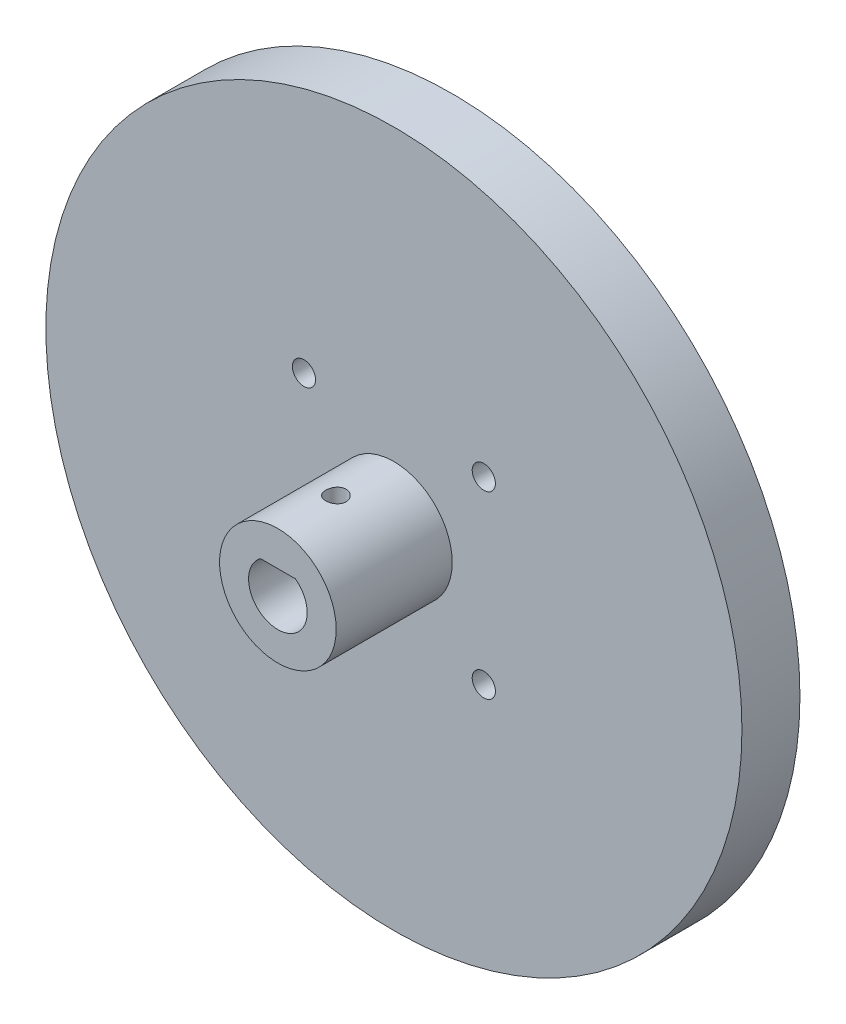
from build123d import *

# Parameters (mm, degrees)
SKETCH1_R               = 60
SKETCH1_R_2             = 2
BOSS_EXTRUDE1_DEPTH     = 10
SKETCH2_R               = 10.05
BOSS_EXTRUDE2_DEPTH     = 20
CUT_EXTRUDE1_DEPTH      = 20
CUT_EXTRUDE1_DEPTH_BACK = 20
SKETCH3_R               = 1.75


with BuildPart() as part:
    # Sketch1 → Boss-Extrude1 (new body)
    with BuildSketch(Plane.XY):
        Circle(SKETCH1_R)
        with Locations((-15.5, 15.5)):
            Circle(SKETCH1_R_2, mode=Mode.SUBTRACT)
        with Locations((15.5, 15.5)):
            Circle(SKETCH1_R_2, mode=Mode.SUBTRACT)
        with Locations((15.5, -15.5)):
            Circle(SKETCH1_R_2, mode=Mode.SUBTRACT)
        with Locations((-15.5, -15.5)):
            Circle(SKETCH1_R_2, mode=Mode.SUBTRACT)
    extrude(amount=BOSS_EXTRUDE1_DEPTH)

    # Sketch2 → Boss-Extrude2 (add)
    with BuildSketch(Plane.XY.offset(10)):
        Circle(SKETCH2_R)
        with BuildLine():
            ThreePointArc((3.016620626, 4.05), (0, -5.05), (-3.016620626, 4.05))
            Line((-3.016620626, 4.05), (3.016620626, 4.05))
        make_face(mode=Mode.SUBTRACT)
    extrude(amount=BOSS_EXTRUDE2_DEPTH)

    # Sketch3 → Cut-Extrude1 (cut, two sides: drawn at the far end of the back side and taken through both)
    with BuildSketch(Plane(origin=(0, 4.05, 0), x_dir=(-1, 0, 0), z_dir=(0, -1, 0)).offset(-CUT_EXTRUDE1_DEPTH_BACK)):
        with Locations((0, -20)):
            Circle(SKETCH3_R)
    extrude(amount=CUT_EXTRUDE1_DEPTH + CUT_EXTRUDE1_DEPTH_BACK, mode=Mode.SUBTRACT)


solid = part.part
